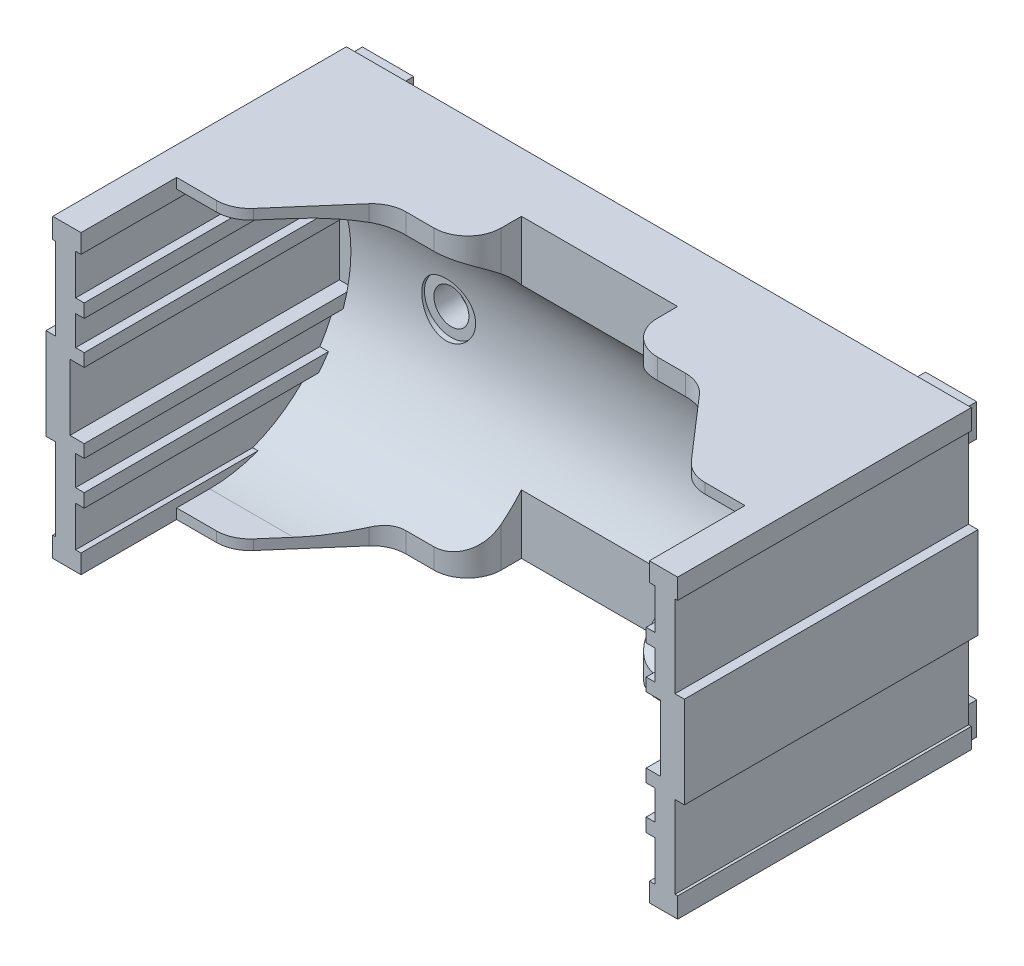
from build123d import *

# Parameters (mm, degrees)
SKETCH1_W            = 58.42
SKETCH1_H            = 27.94
BOSS_EXTRUDE1_DEPTH  = 27.686
SKETCH2_W            = 0.889
SKETCH2_H            = 8.636
SKETCH2_W_2          = 0.254
SKETCH2_H_2          = 1.905
BOSS_EXTRUDE3_DEPTH  = 27.686
CUT_EXTRUDE1_DEPTH   = 27.305
CUT_EXTRUDE3_DEPTH   = 50.528860243
SKETCH6_W            = 0.508
SKETCH6_H            = 1.778
SKETCH6_W_2          = 0.8128
SKETCH6_H_2          = 1.27
SKETCH6_H_3          = 8.636
BOSS_EXTRUDE4_DEPTH  = 27.686
SKETCH7_W            = 1.3462
SKETCH7_H            = 6.223
CUT_EXTRUDE4_DEPTH   = 25.4
SKETCH8_R            = 1.651
CUT_EXTRUDE5_DEPTH   = 44.216030588
SKETCH9_R            = 2.54
CUT_EXTRUDE6_DEPTH   = 25.4
BOSS_EXTRUDE5_DEPTH  = 1.016
MIRROR3_COPY_1_DEPTH = 1.016


with BuildPart() as part:
    # Sketch1 → Boss-Extrude1 (new body)
    with BuildSketch(Plane.XY):
        Rectangle(SKETCH1_W, SKETCH1_H)
    extrude(amount=BOSS_EXTRUDE1_DEPTH)

    # Sketch2 → Boss-Extrude3 (add)
    with BuildSketch(Plane.XY.offset(27.686)):
        with Locations((-29.6545, 0)):
            Rectangle(SKETCH2_W, SKETCH2_H)
        with Locations((-29.337, 13.0175)):
            Rectangle(SKETCH2_W_2, SKETCH2_H_2)
        with Locations((-29.337, -13.0175)):
            Rectangle(SKETCH2_W_2, SKETCH2_H_2)
        with Locations((29.337, -13.0175)):
            Rectangle(SKETCH2_W_2, SKETCH2_H_2)
        with Locations((29.337, 13.0175)):
            Rectangle(SKETCH2_W_2, SKETCH2_H_2)
        with Locations((29.6545, 0)):
            Rectangle(SKETCH2_W, SKETCH2_H)
    extrude(amount=-BOSS_EXTRUDE3_DEPTH)

    # Sketch4 → Cut-Extrude1 (cut, symmetric)
    with BuildSketch(Plane(origin=(0, 0, 0), x_dir=(0, 0, -1), z_dir=(1, 0, 0))):
        with BuildLine():
            Line((-15.5575, 13.0175), (-27.686, 13.0175))
            Line((-27.686, 13.0175), (-27.686, -13.0175))
            Line((-27.686, -13.0175), (-15.5575, -13.0175))
            ThreePointArc((-15.5575, -13.0175), (-2.54, 0), (-15.5575, 13.0175))
        make_face()
    extrude(amount=CUT_EXTRUDE1_DEPTH, both=True, mode=Mode.SUBTRACT)

    # Sketch5 → Cut-Extrude3 (cut, through all)
    with BuildSketch(Plane.XZ.offset(13.97)):
        with BuildLine():
            Line((-27.305, 27.686), (-27.305, 18.669))
            Line((-27.305, 18.669), (-23.037688998, 18.669))
            ThreePointArc((-23.037688998, 18.669), (-21.720466793, 18.382866674), (-20.640662648, 17.576039787))
            Line((-20.640662648, 17.576039787), (-15.589726503, 11.760960213))
            ThreePointArc((-15.589726503, 11.760960213), (-14.509922358, 10.954133326), (-13.192700152, 10.668))
            Line((-13.192700152, 10.668), (-10.541, 10.668))
            ThreePointArc((-10.541, 10.668), (-8.29593597, 9.73806403), (-7.366, 7.493))
            Line((-7.366, 7.493), (-7.366, 5.588))
            Line((-7.366, 5.588), (7.366, 5.588))
            Line((7.366, 5.588), (7.366, 7.493))
            ThreePointArc((7.366, 7.493), (8.29593597, 9.73806403), (10.541, 10.668))
            Line((10.541, 10.668), (13.192700152, 10.668))
            ThreePointArc((13.192700152, 10.668), (14.509922358, 10.954133326), (15.589726503, 11.760960213))
            Line((15.589726503, 11.760960213), (20.640662648, 17.576039787))
            ThreePointArc((20.640662648, 17.576039787), (21.720466793, 18.382866674), (23.037688998, 18.669))
            Line((23.037688998, 18.669), (27.305, 18.669))
            Line((27.305, 18.669), (27.305, 27.686))
            Line((27.305, 27.686), (-27.305, 27.686))
        make_face()
    extrude(amount=-CUT_EXTRUDE3_DEPTH, mode=Mode.SUBTRACT)

    # Sketch6 → Boss-Extrude4 (add)
    with BuildSketch(Plane.XY.offset(27.686)):
        with Locations((-27.051, 13.081)):
            Rectangle(SKETCH6_W, SKETCH6_H)
        with Locations((-26.8986, 7.747)):
            Rectangle(SKETCH6_W_2, SKETCH6_H_2)
        with Locations((-26.8986, 0)):
            Rectangle(SKETCH6_W_2, SKETCH6_H_3)
        with Locations((-26.8986, -7.747)):
            Rectangle(SKETCH6_W_2, SKETCH6_H_2)
        with Locations((-27.051, -13.081)):
            Rectangle(SKETCH6_W, SKETCH6_H)
        with Locations((27.051, -13.081)):
            Rectangle(SKETCH6_W, SKETCH6_H)
        with Locations((26.8986, -7.747)):
            Rectangle(SKETCH6_W_2, SKETCH6_H_2)
        with Locations((26.8986, 0)):
            Rectangle(SKETCH6_W_2, SKETCH6_H_3)
        with Locations((26.8986, 7.747)):
            Rectangle(SKETCH6_W_2, SKETCH6_H_2)
        with Locations((27.051, 13.081)):
            Rectangle(SKETCH6_W, SKETCH6_H)
    extrude(amount=-BOSS_EXTRUDE4_DEPTH)

    # Sketch7 → Cut-Extrude4 (cut)
    with BuildSketch(Plane.XY.offset(27.686)):
        with Locations((-27.1653, 0)):
            Rectangle(SKETCH7_W, SKETCH7_H)
        with Locations((27.1653, 0)):
            Rectangle(SKETCH7_W, SKETCH7_H)
    extrude(amount=-CUT_EXTRUDE4_DEPTH, mode=Mode.SUBTRACT)

    # Sketch8 → Cut-Extrude5 (cut, through all)
    with BuildSketch(Plane.XY.offset(27.686)):
        with Locations((-17.272, 0)):
            Circle(SKETCH8_R)
        with Locations((17.272, 0)):
            Circle(SKETCH8_R)
    extrude(amount=-CUT_EXTRUDE5_DEPTH, mode=Mode.SUBTRACT)

    # Sketch9 → Cut-Extrude6 (cut)
    with BuildSketch(Plane.XY.offset(27.686)):
        with Locations((-17.272, 0)):
            Circle(SKETCH9_R)
        with Locations((17.272, 0)):
            Circle(SKETCH9_R)
    extrude(amount=-CUT_EXTRUDE6_DEPTH, mode=Mode.SUBTRACT)

    # Sketch10 → Boss-Extrude5 (add)
    with BuildSketch(Plane(origin=(0, 0, 0), x_dir=(-1, 0, 0), z_dir=(0, 0, -1))):
        Polygon((-28.963662415, 10.647390084), (-28.963662415, 13.695390084), (-24.137662415, 13.695390084), (-24.137662415, 12.425390084), (-27.693662415, 12.425390084), (-27.693662415, 10.647390084), align=None)
    boss_extrude5 = extrude(amount=BOSS_EXTRUDE5_DEPTH)

    # Mirror2: Boss-Extrude5 across plane
    add(boss_extrude5.mirror(Plane.ZX))

    # Mirror3: Boss-Extrude5 across plane
    add(boss_extrude5.mirror(Plane(origin=(0, 0, 0), x_dir=(0, 0, 1), z_dir=(1, 0, 0))))

    # Mirror3 copy 1 sketch → Mirror3 copy 1 (add)
    with BuildSketch(Plane(origin=(0, 0, 0), x_dir=(1, 0, 0), z_dir=(0, 0, -1))):
        Polygon((-28.963662415, 10.647390084), (-28.963662415, 13.695390084), (-24.137662415, 13.695390084), (-24.137662415, 12.425390084), (-27.693662415, 12.425390084), (-27.693662415, 10.647390084), align=None)
    extrude(amount=MIRROR3_COPY_1_DEPTH)


solid = part.part
